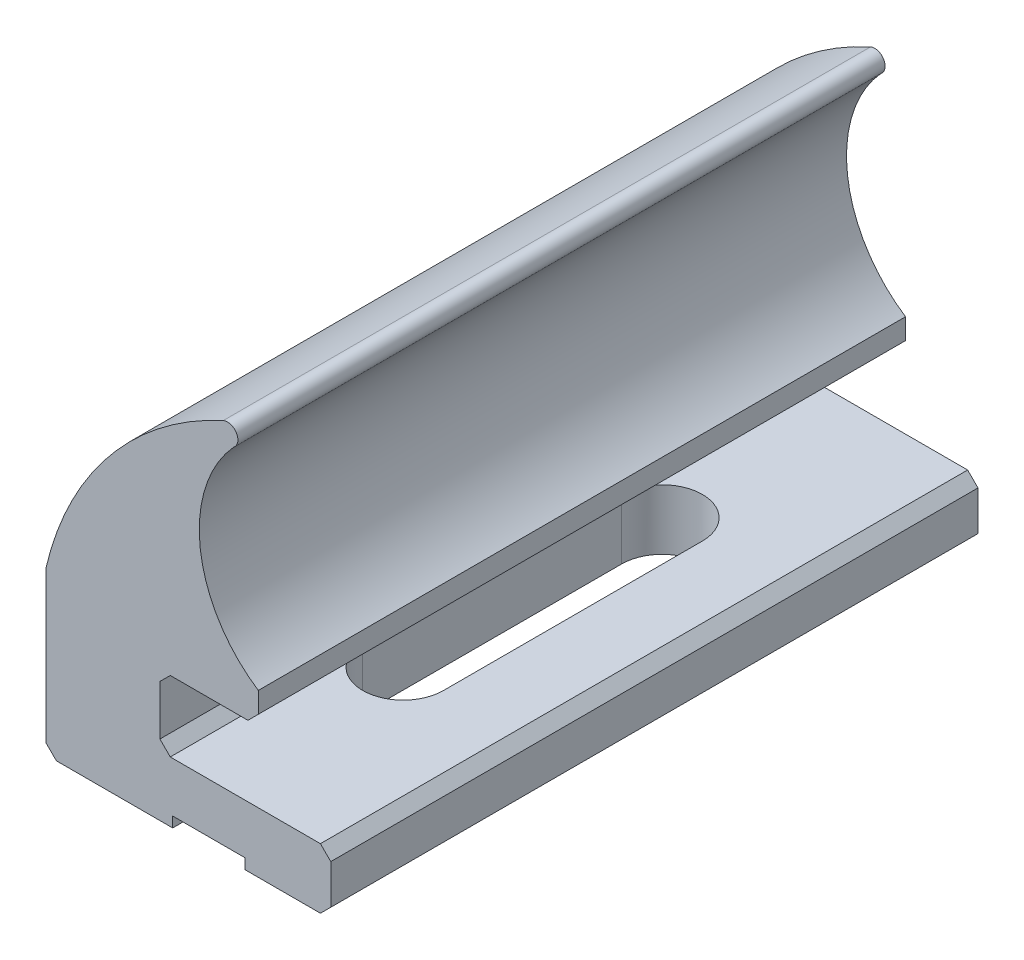
from build123d import *

# Parameters (mm, degrees)
BOSS_EXTRUDE1_DEPTH     = 31.75
CHAMFER1_SIZE           = 0.508
BOSS_EXTRUDE2_DEPTH     = 2.956637053
CUT_EXTRUDE1_REACH      = 41.356
CUT_EXTRUDE2_REACH      = 48.717
CUT_EXTRUDE2_END_RADIUS = 1.9812
SKETCH7_W               = 3.556
SKETCH7_H               = 1.016


with BuildPart() as part:
    # Sketch1 → Boss-Extrude1 (new body)
    with BuildSketch(Plane.XY):
        with BuildLine():
            Line((0, 12.7), (13.97, 12.7))
            Line((13.97, 12.7), (13.97, 15.656637053))
            Line((13.97, 15.656637053), (5.588, 15.656637053))
            Line((5.588, 15.656637053), (5.588, 19.119334391))
            Line((5.588, 19.119334391), (10.414, 19.119334391))
            Line((10.414, 19.119334391), (10.414, 20.643334391))
            ThreePointArc((10.414, 20.643334391), (7.568862019, 25.230360252), (9.20630181, 30.373745063))
            ThreePointArc((9.20630181, 30.373745063), (9.344088063, 31.041104373), (8.694495233, 31.246974853))
            ThreePointArc((8.694495233, 31.246974853), (3.113774689, 26.956545429), (0, 20.643334391))
            Line((0, 20.643334391), (0, 12.7))
        make_face()
    extrude(amount=-BOSS_EXTRUDE1_DEPTH)

    # Chamfer1
    chamfer1_edges = [part.edges().sort_by_distance(p)[0] for p in [
        (0, 12.7, -15.875),
        (13.97, 12.7, -15.875),
        (13.97, 15.656637053, -15.875),
        (5.588, 15.656637053, -15.875),
        (5.588, 19.119334391, -15.875),
        (10.414, 19.119334391, -15.875),
    ]]
    chamfer(chamfer1_edges, length=CHAMFER1_SIZE)

    # Sketch4 → Boss-Extrude2 (add)
    with BuildSketch(Plane.XZ.offset(-12.7)):
        with BuildLine():
            Line((6.012029018, -22.225), (6.012029018, -9.525))
            ThreePointArc((6.012029018, -9.525), (7.993229018, -7.5438), (9.974429018, -9.525))
            Line((9.974429018, -9.525), (9.974429018, -22.225))
            ThreePointArc((9.974429018, -22.225), (7.993229018, -24.2062), (6.012029018, -22.225))
        make_face()
    extrude(amount=-BOSS_EXTRUDE2_DEPTH)

    # Sketch5 → Cut-Extrude1 (cut, up to next)
    with BuildSketch(Plane.XZ.offset(-12.7), mode=Mode.PRIVATE) as cut_extrude1_sk1:
        with BuildLine():
            Line((6.012029018, -22.225), (6.012029018, -9.525))
            ThreePointArc((6.012029018, -9.525), (7.993229018, -7.5438), (9.974429018, -9.525))
            Line((9.974429018, -9.525), (9.974429018, -22.225))
            ThreePointArc((9.974429018, -22.225), (7.993229018, -24.2062), (6.012029018, -22.225))
        make_face()
    cut_extrude1_tool1 = extrude(cut_extrude1_sk1.sketch, amount=-CUT_EXTRUDE1_REACH, mode=Mode.PRIVATE) & part.part
    add(cut_extrude1_tool1.solids().sort_by_distance((7.993229, 12.7, -15.875))[0], mode=Mode.SUBTRACT)

    # Cut-Extrude2: up to this cylinder (the profile starts outside it)
    cut_extrude2_end = Plane(origin=(7.993229018, 12.7, -9.525), z_dir=(0, -1, 0)) * Cylinder(CUT_EXTRUDE2_END_RADIUS, 102.3964, mode=Mode.PRIVATE)
    # Sketch7 → Cut-Extrude2 (cut, up to the surface)
    with BuildSketch(Plane.XY, mode=Mode.PRIVATE) as cut_extrude2_sk1:
        with Locations((7.993229018, 12.7)):
            Rectangle(SKETCH7_W, SKETCH7_H)
    cut_extrude2_tool1 = extrude(cut_extrude2_sk1.sketch, amount=-CUT_EXTRUDE2_REACH, mode=Mode.PRIVATE) - cut_extrude2_end
    add(cut_extrude2_tool1.solids().sort_by_distance((7.993229, 12.7, 0))[0], mode=Mode.SUBTRACT)


solid = part.part
